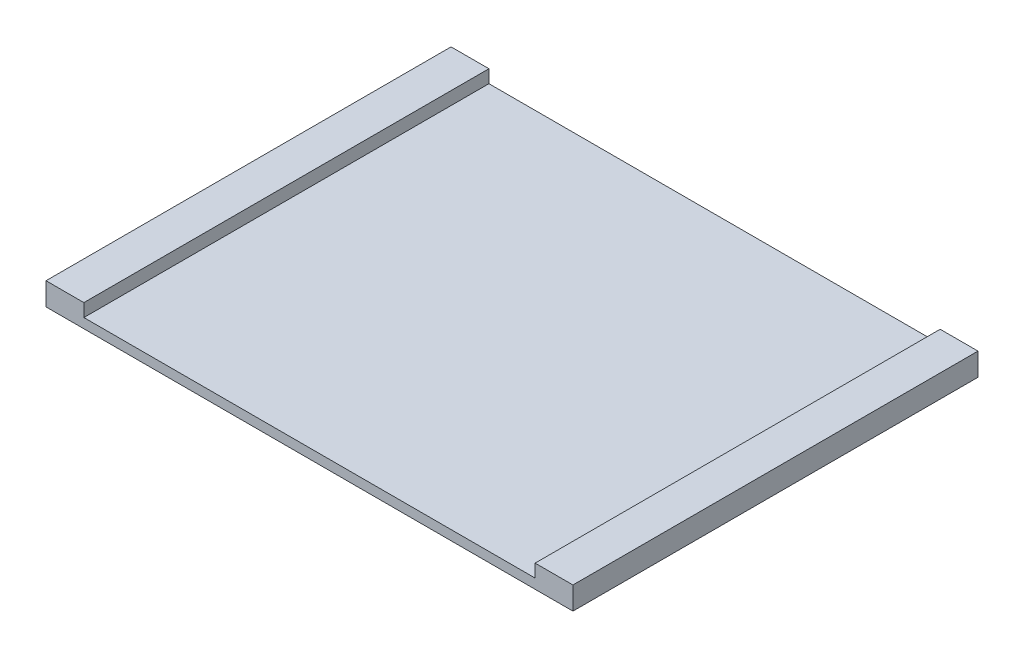
from build123d import *

# Parameters (mm, degrees)
ESQUISSE8_W        = 69.596
ESQUISSE8_H        = 50.8
BOSS_EXTRU_2_DEPTH = 4
ESQUISSE9_W        = 81.28
ESQUISSE9_H        = 62.48
BOSS_EXTRU_3_DEPTH = 1.5
ESQUISSE10_W       = 5.842
ESQUISSE10_H       = 62.48
BOSS_EXTRU_4_DEPTH = 3.5
ESQUISSE11_W       = 5.834410006
ESQUISSE11_H       = 62.48
BOSS_EXTRU_5_DEPTH = 3.5


with BuildPart() as part:
    # Esquisse8 → Boss.-Extru.2 (new body)
    with BuildSketch(Plane(origin=(0, 0, 0), x_dir=(1, 0, 0), z_dir=(0, 1, 0))):
        with Locations((34.798, 25.4)):
            Rectangle(ESQUISSE8_W, ESQUISSE8_H)
    extrude(amount=BOSS_EXTRU_2_DEPTH)

    # Esquisse9 → Boss.-Extru.3 (add)
    with BuildSketch(Plane(origin=(0, 4, 0), x_dir=(1, 0, 0), z_dir=(0, 1, 0))):
        with Locations((34.798, 25.398)):
            Rectangle(ESQUISSE9_W, ESQUISSE9_H)
    extrude(amount=BOSS_EXTRU_3_DEPTH)

    # Esquisse10 → Boss.-Extru.4 (add)
    with BuildSketch(Plane.XZ.offset(-4)):
        with Locations((-2.921, -25.398)):
            Rectangle(ESQUISSE10_W, ESQUISSE10_H)
    extrude(amount=-BOSS_EXTRU_4_DEPTH)

    # Esquisse11 → Boss.-Extru.5 (add)
    with BuildSketch(Plane(origin=(0, 4, 0), x_dir=(-1, 0, 0), z_dir=(0, -1, 0))):
        with Locations((-72.520794997, 25.398)):
            Rectangle(ESQUISSE11_W, ESQUISSE11_H)
    extrude(amount=-BOSS_EXTRU_5_DEPTH)


solid = part.part
